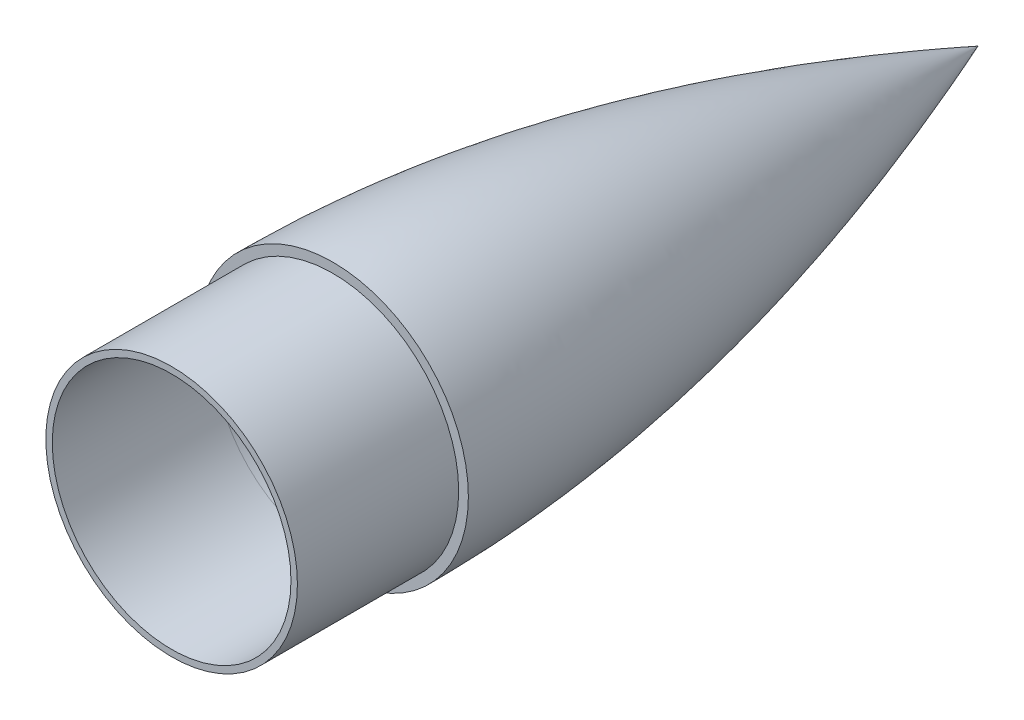
from build123d import *

# Parameters (mm, degrees)
SKETCH18_W          = 20
SKETCH18_H          = 12
BOSS_EXTRUDE2_DEPTH = 10
SKETCH19_R          = 1.5
CUT_EXTRUDE1_DEPTH  = 15
SWEEP2_PROFILE_R    = 5
SKETCH39_R          = 39
SKETCH39_R_2        = 37
BOSS_EXTRUDE4_DEPTH = 50


with BuildPart() as part:
    # Sketch1 → Revolve6 (revolve)
    with BuildSketch(Plane(origin=(0, 0, 0), x_dir=(0, 0, -1), z_dir=(1, 0, 0))):
        with BuildLine():
            Line((0, 42), (0, 37))
            add(Edge.make_bspline(
                [(0, 37), (91.00549434, 37), (198, 0)],
                knots=[0, 0, 0, 1, 1, 1], degree=2))
            Line((198, 0), (200, 0))
            add(Edge.make_bspline(
                [(0, 42), (92.195444573, 42), (200, 0)],
                knots=[0, 0, 0, 1, 1, 1], degree=2))
        make_face()
    revolve(axis=Axis((0, 0, 198), (0, 0, -1)))



with BuildPart() as body_2:
    # Sketch15 → Revolve7 (revolve)
    with BuildSketch(Plane(origin=(0, 0, 0), x_dir=(0, 0, -1), z_dir=(1, 0, 0))):
        with BuildLine():
            Line((0, 37), (0, 0))
            Line((0, 0), (198, 0))
            add(Edge.make_bspline(
                [(0, 37), (91.00549434, 37), (198, 0)],
                knots=[0, 0, 0, 1, 1, 1], degree=2))
        make_face()
    revolve(axis=Axis((0, 0, -198), (0, 0, 1)))

    # Sketch16 → Cut-Revolve1 (revolve, cut)
    with BuildSketch(Plane(origin=(0, 0, 0), x_dir=(0, 0, -1), z_dir=(1, 0, 0))):
        with BuildLine():
            Line((85, 1.5e-08), (0, 0))
            Line((0, 0), (2.5e-08, 37))
            add(Edge.make_bspline(
                [(2.5e-08, 37), (40.886337168, 36.999999998), (85, 29.531680157)],
                knots=[0, 0, 0, 1, 1, 1], degree=2))
            Line((85, 29.531680157), (85, 1.5e-08))
        make_face()
    revolve(axis=Axis((0, 1.5e-08, -85), (0, -1.7796762949934384e-10, 1.0)), mode=Mode.SUBTRACT)


with BuildPart() as part_1:
    add(part.part)

    add(body_2.part)  # Boss-Extrude2 merges body 2
    # Sketch18 → Boss-Extrude2 (add)
    with BuildSketch(Plane.XY.offset(-85.000000003)):
        with Locations((0, 18)):
            Rectangle(SKETCH18_W, SKETCH18_H)
        with Locations((0, -18)):
            Rectangle(SKETCH18_W, SKETCH18_H)
    extrude(amount=BOSS_EXTRUDE2_DEPTH)

    # Sketch19 → Cut-Extrude1 (cut)
    with BuildSketch(Plane.XY.offset(-75.000000003)):
        with Locations((8, -18)):
            Circle(SKETCH19_R)
        with Locations((-8, -18)):
            Circle(SKETCH19_R)
        with Locations((8, 18)):
            Circle(SKETCH19_R)
        with Locations((-8, 18)):
            Circle(SKETCH19_R)
    extrude(amount=-CUT_EXTRUDE1_DEPTH, mode=Mode.SUBTRACT)

    # Sweep2: sweep along a path in Sketch22
    with BuildLine(Plane(origin=(0, 0, 0), x_dir=(0, 0, -1), z_dir=(1, 0, 0))) as sweep2_path:
        ThreePointArc((74.999999999, 18.000000013), (59.443329555, -3e-09), (75.000000005, -18.000000014))
    # Sweep2 profile (on start of the path) → Sweep2 (sweep)
    with BuildSketch(Plane(origin=(0, 18.000000013, -74.999999999), x_dir=(0, 0.9894527315338124, 0.14485610812208577), z_dir=(0, -0.14485610812208577, 0.9894527315338124))):
        Circle(SWEEP2_PROFILE_R)
    sweep(path=sweep2_path.line)

    # Sketch39 → Boss-Extrude4 (add)
    with BuildSketch(Plane.XY):
        Circle(SKETCH39_R)
        Circle(SKETCH39_R_2, mode=Mode.SUBTRACT)
    extrude(amount=BOSS_EXTRUDE4_DEPTH)


solid = part_1.part
